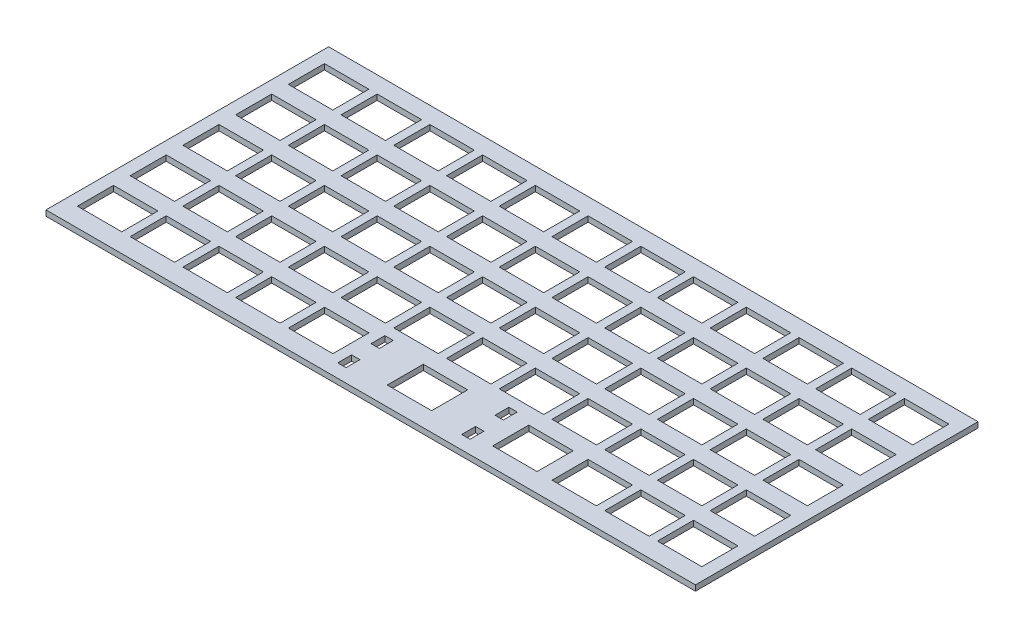
from build123d import *

# Parameters (mm, degrees)
SKETCH1_W           = 234
SKETCH1_H           = 101.822563904
SKETCH1_W_2         = 3
SKETCH1_H_2         = 5
SKETCH1_W_3         = 16
SKETCH1_H_3         = 13
BOSS_EXTRUDE2_DEPTH = 2


with BuildPart() as part:
    # Sketch1 → Boss-Extrude2 (new body)
    with BuildSketch(Plane(origin=(0, 0, 0), x_dir=(1, 0, 0), z_dir=(0, 1, 0))):
        with Locations((-1.108626563, -6.665568915)):
            Rectangle(SKETCH1_W, SKETCH1_H)
        with Locations((-16.32093847, -38.254286963)):
            Rectangle(SKETCH1_W_2, SKETCH1_H_2, mode=Mode.SUBTRACT)
        with Locations((-105.608626563, 31.745713037)):
            Rectangle(SKETCH1_W_3, SKETCH1_H_3, mode=Mode.SUBTRACT)
        with Locations((-86.608626563, 31.745713037)):
            Rectangle(SKETCH1_W_3, SKETCH1_H_3, mode=Mode.SUBTRACT)
        with Locations((-67.608626563, 31.745713037)):
            Rectangle(SKETCH1_W_3, SKETCH1_H_3, mode=Mode.SUBTRACT)
        with Locations((-105.608626563, 12.745713037)):
            Rectangle(SKETCH1_W_3, SKETCH1_H_3, mode=Mode.SUBTRACT)
        with Locations((-86.608626563, 12.745713037)):
            Rectangle(SKETCH1_W_3, SKETCH1_H_3, mode=Mode.SUBTRACT)
        with Locations((-67.608626563, 12.745713037)):
            Rectangle(SKETCH1_W_3, SKETCH1_H_3, mode=Mode.SUBTRACT)
        with Locations((-86.608626563, -6.254286963)):
            Rectangle(SKETCH1_W_3, SKETCH1_H_3, mode=Mode.SUBTRACT)
        with Locations((-105.608626563, -6.254286963)):
            Rectangle(SKETCH1_W_3, SKETCH1_H_3, mode=Mode.SUBTRACT)
        with Locations((-67.608626563, -6.254286963)):
            Rectangle(SKETCH1_W_3, SKETCH1_H_3, mode=Mode.SUBTRACT)
        with Locations((-48.608626563, -6.254286963)):
            Rectangle(SKETCH1_W_3, SKETCH1_H_3, mode=Mode.SUBTRACT)
        with Locations((-48.608626563, 31.745713037)):
            Rectangle(SKETCH1_W_3, SKETCH1_H_3, mode=Mode.SUBTRACT)
        with Locations((-48.608626563, 12.745713037)):
            Rectangle(SKETCH1_W_3, SKETCH1_H_3, mode=Mode.SUBTRACT)
        with Locations((-105.608626563, -25.254286963)):
            Rectangle(SKETCH1_W_3, SKETCH1_H_3, mode=Mode.SUBTRACT)
        with Locations((-86.608626563, -25.254286963)):
            Rectangle(SKETCH1_W_3, SKETCH1_H_3, mode=Mode.SUBTRACT)
        with Locations((-67.608626563, -25.254286963)):
            Rectangle(SKETCH1_W_3, SKETCH1_H_3, mode=Mode.SUBTRACT)
        with Locations((-48.608626563, -25.254286963)):
            Rectangle(SKETCH1_W_3, SKETCH1_H_3, mode=Mode.SUBTRACT)
        with Locations((-105.608626563, -44.254286963)):
            Rectangle(SKETCH1_W_3, SKETCH1_H_3, mode=Mode.SUBTRACT)
        with Locations((-86.608626563, -44.254286963)):
            Rectangle(SKETCH1_W_3, SKETCH1_H_3, mode=Mode.SUBTRACT)
        with Locations((-67.608626563, -44.254286963)):
            Rectangle(SKETCH1_W_3, SKETCH1_H_3, mode=Mode.SUBTRACT)
        with Locations((-48.608626563, -44.254286963)):
            Rectangle(SKETCH1_W_3, SKETCH1_H_3, mode=Mode.SUBTRACT)
        with Locations((103.391373437, -44.254286963)):
            Rectangle(SKETCH1_W_3, SKETCH1_H_3, mode=Mode.SUBTRACT)
        with Locations((84.391373437, -25.254286963)):
            Rectangle(SKETCH1_W_3, SKETCH1_H_3, mode=Mode.SUBTRACT)
        with Locations((84.391373437, -44.254286963)):
            Rectangle(SKETCH1_W_3, SKETCH1_H_3, mode=Mode.SUBTRACT)
        with Locations((103.391373437, -25.254286963)):
            Rectangle(SKETCH1_W_3, SKETCH1_H_3, mode=Mode.SUBTRACT)
        with Locations((65.391373437, -6.254286963)):
            Rectangle(SKETCH1_W_3, SKETCH1_H_3, mode=Mode.SUBTRACT)
        with Locations((65.391373437, -25.254286963)):
            Rectangle(SKETCH1_W_3, SKETCH1_H_3, mode=Mode.SUBTRACT)
        with Locations((65.391373437, -44.254286963)):
            Rectangle(SKETCH1_W_3, SKETCH1_H_3, mode=Mode.SUBTRACT)
        with Locations((84.391373437, -6.254286963)):
            Rectangle(SKETCH1_W_3, SKETCH1_H_3, mode=Mode.SUBTRACT)
        with Locations((103.391373437, -6.254286963)):
            Rectangle(SKETCH1_W_3, SKETCH1_H_3, mode=Mode.SUBTRACT)
        with Locations((-29.5569646, -44.254286963)):
            Rectangle(SKETCH1_W_3, SKETCH1_H_3, mode=Mode.SUBTRACT)
        with Locations((-29.608626563, -25.254286963)):
            Rectangle(SKETCH1_W_3, SKETCH1_H_3, mode=Mode.SUBTRACT)
        with Locations((-29.608626563, -6.254286963)):
            Rectangle(SKETCH1_W_3, SKETCH1_H_3, mode=Mode.SUBTRACT)
        with Locations((-29.608626563, 12.745713037)):
            Rectangle(SKETCH1_W_3, SKETCH1_H_3, mode=Mode.SUBTRACT)
        with Locations((-29.608626563, 31.745713037)):
            Rectangle(SKETCH1_W_3, SKETCH1_H_3, mode=Mode.SUBTRACT)
        with Locations((65.391373437, 12.745713037)):
            Rectangle(SKETCH1_W_3, SKETCH1_H_3, mode=Mode.SUBTRACT)
        with Locations((46.391373437, 31.745713037)):
            Rectangle(SKETCH1_W_3, SKETCH1_H_3, mode=Mode.SUBTRACT)
        with Locations((46.391373437, 12.745713037)):
            Rectangle(SKETCH1_W_3, SKETCH1_H_3, mode=Mode.SUBTRACT)
        with Locations((65.391373437, 31.745713037)):
            Rectangle(SKETCH1_W_3, SKETCH1_H_3, mode=Mode.SUBTRACT)
        with Locations((84.391373437, 31.745713037)):
            Rectangle(SKETCH1_W_3, SKETCH1_H_3, mode=Mode.SUBTRACT)
        with Locations((103.391373437, 31.745713037)):
            Rectangle(SKETCH1_W_3, SKETCH1_H_3, mode=Mode.SUBTRACT)
        with Locations((84.391373437, 12.745713037)):
            Rectangle(SKETCH1_W_3, SKETCH1_H_3, mode=Mode.SUBTRACT)
        with Locations((103.391373437, 12.745713037)):
            Rectangle(SKETCH1_W_3, SKETCH1_H_3, mode=Mode.SUBTRACT)
        with Locations((46.391373437, -6.254286963)):
            Rectangle(SKETCH1_W_3, SKETCH1_H_3, mode=Mode.SUBTRACT)
        with Locations((46.391373437, -25.254286963)):
            Rectangle(SKETCH1_W_3, SKETCH1_H_3, mode=Mode.SUBTRACT)
        with Locations((27.391373437, -6.254286963)):
            Rectangle(SKETCH1_W_3, SKETCH1_H_3, mode=Mode.SUBTRACT)
        with Locations((27.391373437, -25.254286963)):
            Rectangle(SKETCH1_W_3, SKETCH1_H_3, mode=Mode.SUBTRACT)
        with Locations((27.391373437, 12.745713037)):
            Rectangle(SKETCH1_W_3, SKETCH1_H_3, mode=Mode.SUBTRACT)
        with Locations((27.391373437, 31.745713037)):
            Rectangle(SKETCH1_W_3, SKETCH1_H_3, mode=Mode.SUBTRACT)
        with Locations((8.391373437, 31.745713037)):
            Rectangle(SKETCH1_W_3, SKETCH1_H_3, mode=Mode.SUBTRACT)
        with Locations((-10.608626563, 31.745713037)):
            Rectangle(SKETCH1_W_3, SKETCH1_H_3, mode=Mode.SUBTRACT)
        with Locations((-10.608626563, 12.745713037)):
            Rectangle(SKETCH1_W_3, SKETCH1_H_3, mode=Mode.SUBTRACT)
        with Locations((8.391373437, 12.745713037)):
            Rectangle(SKETCH1_W_3, SKETCH1_H_3, mode=Mode.SUBTRACT)
        with Locations((8.391373437, -6.254286963)):
            Rectangle(SKETCH1_W_3, SKETCH1_H_3, mode=Mode.SUBTRACT)
        with Locations((-10.608626563, -6.254286963)):
            Rectangle(SKETCH1_W_3, SKETCH1_H_3, mode=Mode.SUBTRACT)
        with Locations((-10.608626563, -25.254286963)):
            Rectangle(SKETCH1_W_3, SKETCH1_H_3, mode=Mode.SUBTRACT)
        with Locations((8.391373437, -25.254286963)):
            Rectangle(SKETCH1_W_3, SKETCH1_H_3, mode=Mode.SUBTRACT)
        with Locations((44.016373437, -44.254286963)):
            Rectangle(SKETCH1_W_3, SKETCH1_H_3, mode=Mode.SUBTRACT)
        with Locations((6.016373437, -44.254286963)):
            Rectangle(SKETCH1_W_3, SKETCH1_H_3, mode=Mode.SUBTRACT)
        with Locations((28.353685343, -38.254286963)):
            Rectangle(SKETCH1_W_2, SKETCH1_H_2, mode=Mode.SUBTRACT)
        with Locations((-16.32093847, -50.254286963)):
            Rectangle(SKETCH1_W_2, SKETCH1_H_2, mode=Mode.SUBTRACT)
        with Locations((28.353685343, -50.254286963)):
            Rectangle(SKETCH1_W_2, SKETCH1_H_2, mode=Mode.SUBTRACT)
    extrude(amount=BOSS_EXTRUDE2_DEPTH)


solid = part.part
